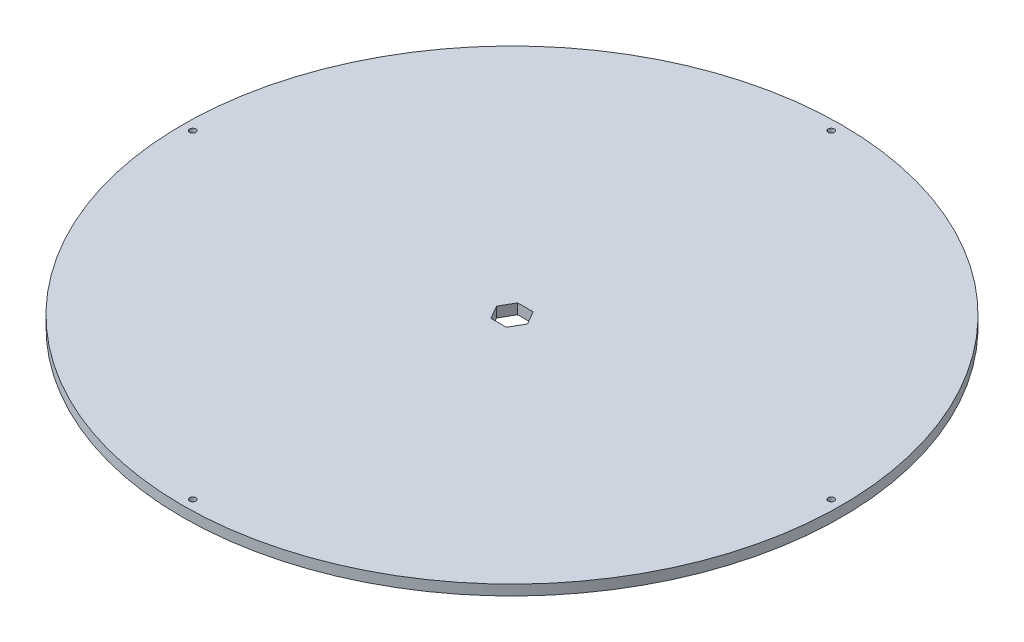
from build123d import *

# Parameters (mm, degrees)
SKETCH1_R           = 160
SKETCH1_R_2         = 1.5
BOSS_EXTRUDE1_DEPTH = 5


with BuildPart() as part:
    # Sketch1 → Boss-Extrude1 (new body)
    with BuildSketch(Plane(origin=(0, 0, 0), x_dir=(1, 0, 0), z_dir=(0, 1, 0))):
        with Locations(Location((0, 0, 0), (0, 0, 270))):
            Circle(SKETCH1_R)
        with Locations(Location((155, 0, 0), (0, 0, 270))):
            Circle(SKETCH1_R_2, mode=Mode.SUBTRACT)
        with Locations(Location((0, -155, 0), (0, 0, 270))):
            Circle(SKETCH1_R_2, mode=Mode.SUBTRACT)
        with Locations(Location((-155, 0, 0), (0, 0, 270))):
            Circle(SKETCH1_R_2, mode=Mode.SUBTRACT)
        with Locations(Location((0, 155, 0), (0, 0, 270))):
            Circle(SKETCH1_R_2, mode=Mode.SUBTRACT)
        Polygon((7.505553499, 0), (3.75277675, 6.5), (-3.75277675, 6.5), (-7.505553499, 0), (-3.75277675, -6.5), (3.75277675, -6.5), align=None, mode=Mode.SUBTRACT)
    extrude(amount=-BOSS_EXTRUDE1_DEPTH)


solid = part.part
